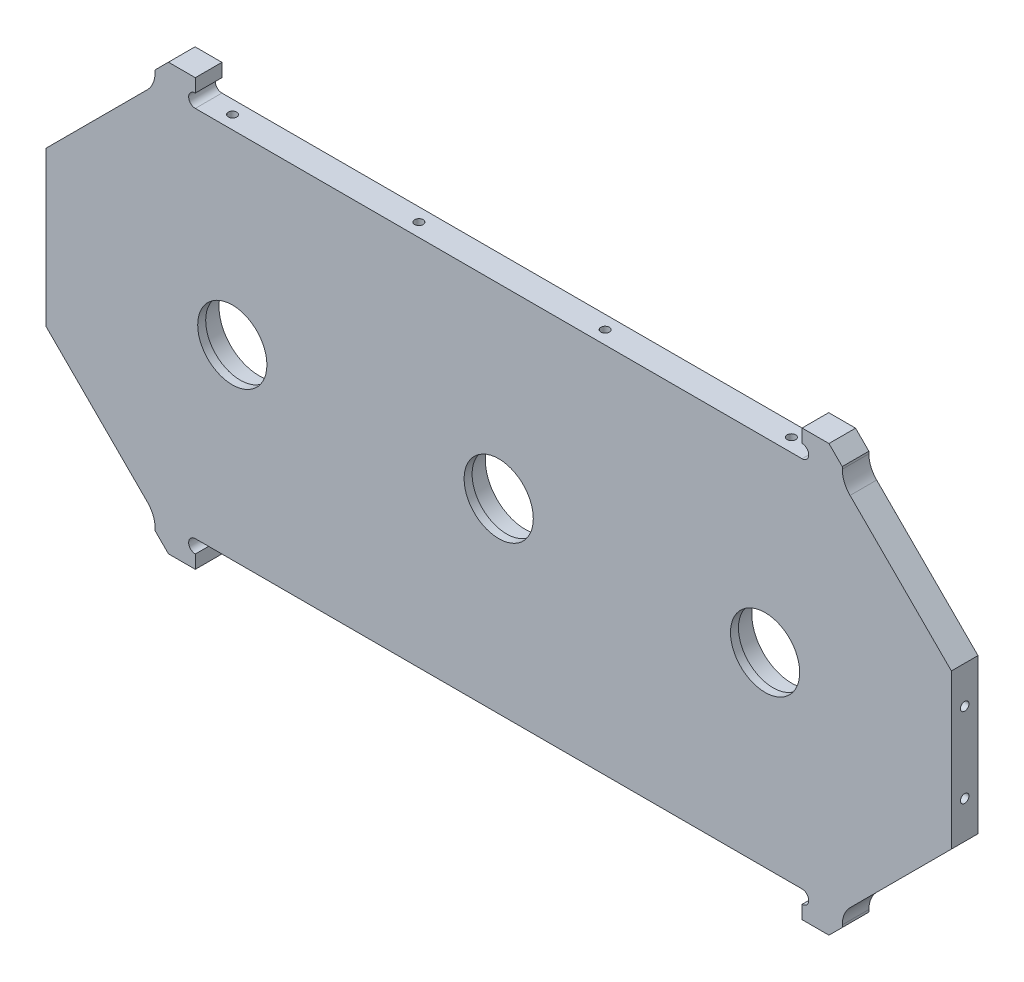
from build123d import *

# Parameters (mm, degrees)
SKETCH1_R               = 13
EXTRUDE1_DEPTH          = 10
SKETCH2_R               = 15
EXTRUDE2_DEPTH          = 7
EXTRUDE3_DEPTH          = 8
FILLET2_R               = 2
SKETCH4_R               = 1.6
EXTRUDE4_DEPTH          = 6
SKETCH5_W               = 15.094949366
SKETCH5_H               = 10
EXTRUDE5_DEPTH          = 10
SKETCH6_R               = 2.5
EXTRUDE6_DEPTH          = 189.23923608
MIRROR2_COPY_1_SKETCH_W = 15.094949366
MIRROR2_COPY_1_SKETCH_H = 10
MIRROR2_COPY_1_DEPTH    = 10
MIRROR2_COPY_2_SKETCH_R = 2.5
MIRROR2_COPY_2_DEPTH    = 189.23923608
FILLET3_R               = 10
CHAMFER1_SIZE           = 5
EXTRUDE7_REACH          = 351.623
SKETCH7_R               = 1.6


with BuildPart() as part:
    # Sketch1 → Extrude1 (new body)
    # profile 1 of 11: a face of its own
    with BuildSketch(Plane.XY):
        with BuildLine():
            Line((-129.094949366, 70), (-149.597474521, 49.497474845))
            ThreePointArc((-149.597474521, 49.497474845), (-126.88784016, 64.67156732), (-100.1, 70))
            Line((-100.1, 70), (-129.094949366, 70))
        make_face()
    # profile 2 of 11: a face of its own
    with BuildSketch(Plane.XY):
        with BuildLine():
            Line((-170.1, 28.994949366), (-170.1, 0))
            ThreePointArc((-170.1, 0), (-164.771567232, 26.787840371), (-149.597474521, 49.497474845))
            Line((-149.597474521, 49.497474845), (-170.1, 28.994949366))
        make_face()
    # profile 3 of 11: a face of its own
    with BuildSketch(Plane.XY):
        with BuildLine():
            Line((-170.1, -28.994949366), (-149.597474341, -49.497475025))
            ThreePointArc((-149.597474341, -49.497475025), (-164.771567183, -26.787840489), (-170.1, 0))
            Line((-170.1, 0), (-170.1, -28.994949366))
        make_face()
    # profile 4 of 11: a face of its own
    with BuildSketch(Plane.XY):
        with BuildLine():
            Line((-129.094949366, -70), (-100.1, -70))
            ThreePointArc((-100.1, -70), (-126.887840042, -64.671567368), (-149.597474341, -49.497475025))
            Line((-149.597474341, -49.497475025), (-129.094949366, -70))
        make_face()
    # profile 5 of 11: a face of its own
    with BuildSketch(Plane.XY):
        with BuildLine():
            Line((-100.1, -70), (-71.105050634, -70))
            Line((-71.105050634, -70), (-30.1, -28.994949366))
            Line((-30.1, -28.994949366), (-30.1, 28.994949366))
            Line((-30.1, 28.994949366), (-71.105050634, 70))
            Line((-71.105050634, 70), (-100.1, 70))
            ThreePointArc((-100.1, 70), (-126.88784016, 64.67156732), (-149.597474521, 49.497474845))
            ThreePointArc((-149.597474521, 49.497474845), (-164.771567232, 26.787840371), (-170.1, 0))
            ThreePointArc((-170.1, 0), (-164.771567183, -26.787840489), (-149.597474341, -49.497475025))
            ThreePointArc((-149.597474341, -49.497475025), (-126.887840042, -64.671567368), (-100.1, -70))
        make_face()
        with Locations((-100.1, 0)):
            Circle(SKETCH1_R, mode=Mode.SUBTRACT)
    # profile 6 of 11: a face of its own
    with BuildSketch(Plane.XY):
        Polygon((-71.105050634, -70), (71.105050634, -70), (30.1, -28.994949366), (30.1, 28.994949366), (71.105050634, 70), (-71.105050634, 70), (-30.1, 28.994949366), (-30.1, -28.994949366), align=None)
        Circle(SKETCH1_R, mode=Mode.SUBTRACT)
    # profile 7 of 11: a face of its own
    with BuildSketch(Plane.XY):
        with BuildLine():
            Line((71.105050634, -70), (100.1, -70))
            ThreePointArc((100.1, -70), (126.887840351, -64.67156724), (149.597474814, -49.497474552))
            ThreePointArc((149.597474814, -49.497474552), (164.77156738, -26.787840014), (170.1, 3.59e-07))
            ThreePointArc((170.1, 3.59e-07), (164.771567229, 26.787840379), (149.597474764, 49.497474602))
            ThreePointArc((149.597474764, 49.497474602), (126.887840318, 64.671567254), (100.1, 70))
            Line((100.1, 70), (71.105050634, 70))
            Line((71.105050634, 70), (30.1, 28.994949366))
            Line((30.1, 28.994949366), (30.1, -28.994949366))
            Line((30.1, -28.994949366), (71.105050634, -70))
        make_face()
        with Locations((100.1, 0)):
            Circle(SKETCH1_R, mode=Mode.SUBTRACT)
    # profile 8 of 11: a face of its own
    with BuildSketch(Plane.XY):
        with BuildLine():
            ThreePointArc((149.597474814, -49.497474552), (126.887840351, -64.67156724), (100.1, -70))
            Line((100.1, -70), (129.094949366, -70))
            Line((129.094949366, -70), (149.597474814, -49.497474552))
        make_face()
    # profile 9 of 11: a face of its own
    with BuildSketch(Plane.XY):
        with BuildLine():
            ThreePointArc((170.1, 3.59e-07), (164.77156738, -26.787840014), (149.597474814, -49.497474552))
            Line((149.597474814, -49.497474552), (170.1, -28.994949366))
            Line((170.1, -28.994949366), (170.1, 3.59e-07))
        make_face()
    # profile 10 of 11: a face of its own
    with BuildSketch(Plane.XY):
        with BuildLine():
            ThreePointArc((149.597474764, 49.497474602), (164.771567229, 26.787840379), (170.1, 3.59e-07))
            Line((170.1, 3.59e-07), (170.1, 28.994949366))
            Line((170.1, 28.994949366), (149.597474764, 49.497474602))
        make_face()
    # profile 11 of 11: a face of its own
    with BuildSketch(Plane.XY):
        with BuildLine():
            ThreePointArc((100.1, 70), (126.887840318, 64.671567254), (149.597474764, 49.497474602))
            Line((149.597474764, 49.497474602), (129.094949366, 70))
            Line((129.094949366, 70), (100.1, 70))
        make_face()
    extrude(amount=EXTRUDE1_DEPTH)

    # Sketch2 → Extrude2 (cut)
    with BuildSketch(Plane(origin=(0, 0, 0), x_dir=(-1, 0, 0), z_dir=(0, 0, -1))):
        Circle(SKETCH2_R)
        with Locations((-100.1, 0)):
            Circle(SKETCH2_R)
        with Locations((100.1, 0)):
            Circle(SKETCH2_R)
    extrude(amount=-EXTRUDE2_DEPTH, mode=Mode.SUBTRACT)

    # Sketch3 → Extrude3 (cut)
    with BuildSketch(Plane(origin=(0, 0, 0), x_dir=(-1, 0, 0), z_dir=(0, 0, -1))):
        with BuildLine():
            Line((-109.178349605, 16.690822881), (-128.140401721, 62.469266271))
            Line((-128.140401721, 62.469266271), (-162.569266271, 28.040401721))
            Line((-162.569266271, 28.040401721), (-116.790822881, 9.078349605))
            ThreePointArc((-116.790822881, 9.078349605), (-113.535028843, 13.435028843), (-109.178349605, 16.690822881))
        make_face()
        with BuildLine():
            ThreePointArc((-118.321556611, -5.382831475), (-119.1, 0), (-118.321556611, 5.382831475))
            Line((-118.321556611, 5.382831475), (-164.1, 24.344883591))
            Line((-164.1, 24.344883591), (-164.1, -24.344883591))
            Line((-164.1, -24.344883591), (-118.321556611, -5.382831475))
        make_face()
        with BuildLine():
            ThreePointArc((-109.178349605, -16.690822881), (-113.535028843, -13.435028843), (-116.790822881, -9.078349605))
            Line((-116.790822881, -9.078349605), (-162.569266271, -28.040401721))
            Line((-162.569266271, -28.040401721), (-128.140401721, -62.469266271))
            Line((-128.140401721, -62.469266271), (-109.178349605, -16.690822881))
        make_face()
        with BuildLine():
            Line((-75.755116409, -64), (-94.717168525, -18.221556611))
            ThreePointArc((-94.717168525, -18.221556611), (-100.1, -19), (-105.482831475, -18.221556611))
            Line((-105.482831475, -18.221556611), (-124.444883591, -64))
            Line((-124.444883591, -64), (-75.755116409, -64))
        make_face()
        with BuildLine():
            Line((-59.635919851, -64), (-5.22625186, -41.462777594))
            Line((-5.22625186, -41.462777594), (-83.409177119, -9.078349605))
            ThreePointArc((-83.409177119, -9.078349605), (-86.664971157, -13.435028843), (-91.021650395, -16.690822881))
            Line((-91.021650395, -16.690822881), (-71.425547608, -64))
            Line((-71.425547608, -64), (-59.635919851, -64))
        make_face()
        with BuildLine():
            ThreePointArc((-2, -18.894443628), (-13.435028843, -13.435028843), (-18.894443628, -2))
            Line((-18.894443628, -2), (-81.205556372, -2))
            ThreePointArc((-81.205556372, -2), (-81.465079672, -3.706716118), (-81.878443389, -5.382831475))
            Line((-81.878443389, -5.382831475), (-2, -38.469566068))
            Line((-2, -38.469566068), (-2, -18.894443628))
        make_face()
        with BuildLine():
            Line((-2, 18.894443628), (-2, 38.469566068))
            Line((-2, 38.469566068), (-81.878443389, 5.382831475))
            ThreePointArc((-81.878443389, 5.382831475), (-81.465079672, 3.706716118), (-81.205556372, 2))
            Line((-81.205556372, 2), (-18.894443628, 2))
            ThreePointArc((-18.894443628, 2), (-13.435028843, 13.435028843), (-2, 18.894443628))
        make_face()
        with BuildLine():
            Line((-5.22625186, 41.462777594), (-59.635919851, 64))
            Line((-59.635919851, 64), (-71.425547608, 64))
            Line((-71.425547608, 64), (-91.021650395, 16.690822881))
            ThreePointArc((-91.021650395, 16.690822881), (-86.664971157, 13.435028843), (-83.409177119, 9.078349605))
            Line((-83.409177119, 9.078349605), (-5.22625186, 41.462777594))
        make_face()
        with BuildLine():
            Line((-94.717168525, 18.221556611), (-75.755116409, 64))
            Line((-75.755116409, 64), (-124.444883591, 64))
            Line((-124.444883591, 64), (-105.482831475, 18.221556611))
            ThreePointArc((-105.482831475, 18.221556611), (-100.1, 19), (-94.717168525, 18.221556611))
        make_face()
        Polygon((-2, 44.455989119), (-2, 64), (-49.183416132, 64), align=None)
        Polygon((2, 44.455989119), (2, 64), (-2, 64), (-2, 44.455989119), (0, 43.627561994), align=None)
        Polygon((2, 44.455989119), (49.183416132, 64), (2, 64), align=None)
        Polygon((-2, -64), (-2, -44.455989119), (-49.183416132, -64), align=None)
        Polygon((49.183416132, -64), (2, -44.455989119), (2, -64), align=None)
        Polygon((2, -44.455989119), (0, -43.627561994), (-2, -44.455989119), (-2, -64), (2, -64), align=None)
        with BuildLine():
            ThreePointArc((91.021650395, -16.690822881), (86.664971157, -13.435028843), (83.409177119, -9.078349605))
            Line((83.409177119, -9.078349605), (5.22625186, -41.462777594))
            Line((5.22625186, -41.462777594), (59.635919851, -64))
            Line((59.635919851, -64), (71.425547608, -64))
            Line((71.425547608, -64), (91.021650395, -16.690822881))
        make_face()
        with BuildLine():
            ThreePointArc((81.878443389, -5.382831475), (81.465079672, -3.706716118), (81.205556372, -2))
            Line((81.205556372, -2), (18.894443628, -2))
            ThreePointArc((18.894443628, -2), (13.435028843, -13.435028843), (2, -18.894443628))
            Line((2, -18.894443628), (2, -38.469566068))
            Line((2, -38.469566068), (81.878443389, -5.382831475))
        make_face()
        with BuildLine():
            ThreePointArc((81.205556372, 2), (81.465079672, 3.706716118), (81.878443389, 5.382831475))
            Line((81.878443389, 5.382831475), (2, 38.469566068))
            Line((2, 38.469566068), (2, 18.894443628))
            ThreePointArc((2, 18.894443628), (13.435028843, 13.435028843), (18.894443628, 2))
            Line((18.894443628, 2), (81.205556372, 2))
        make_face()
        with BuildLine():
            Line((91.021650395, 16.690822881), (71.425547608, 64))
            Line((71.425547608, 64), (59.635919851, 64))
            Line((59.635919851, 64), (5.22625186, 41.462777594))
            Line((5.22625186, 41.462777594), (83.409177119, 9.078349605))
            ThreePointArc((83.409177119, 9.078349605), (86.664971157, 13.435028843), (91.021650395, 16.690822881))
        make_face()
        with BuildLine():
            Line((105.482831475, 18.221556611), (124.444883591, 64))
            Line((124.444883591, 64), (75.755116409, 64))
            Line((75.755116409, 64), (94.717168525, 18.221556611))
            ThreePointArc((94.717168525, 18.221556611), (100.1, 19), (105.482831475, 18.221556611))
        make_face()
        with BuildLine():
            Line((162.569266271, 28.040401721), (128.140401721, 62.469266271))
            Line((128.140401721, 62.469266271), (109.178349605, 16.690822881))
            ThreePointArc((109.178349605, 16.690822881), (113.535028843, 13.435028843), (116.790822881, 9.078349605))
            Line((116.790822881, 9.078349605), (162.569266271, 28.040401721))
        make_face()
        with BuildLine():
            Line((164.1, -24.344883591), (164.1, 24.344883591))
            Line((164.1, 24.344883591), (118.321556611, 5.382831475))
            ThreePointArc((118.321556611, 5.382831475), (118.904382144, 2.719413944), (119.1, 0))
            ThreePointArc((119.1, 0), (118.904382144, -2.719413944), (118.321556611, -5.382831475))
            Line((118.321556611, -5.382831475), (164.1, -24.344883591))
        make_face()
        with BuildLine():
            Line((128.140401721, -62.469266271), (162.569266271, -28.040401721))
            Line((162.569266271, -28.040401721), (116.790822881, -9.078349605))
            ThreePointArc((116.790822881, -9.078349605), (113.535028843, -13.435028843), (109.178349605, -16.690822881))
            Line((109.178349605, -16.690822881), (128.140401721, -62.469266271))
        make_face()
        with BuildLine():
            Line((124.444883591, -64), (105.482831475, -18.221556611))
            ThreePointArc((105.482831475, -18.221556611), (100.1, -19), (94.717168525, -18.221556611))
            Line((94.717168525, -18.221556611), (75.755116409, -64))
            Line((75.755116409, -64), (124.444883591, -64))
        make_face()
    extrude(amount=-EXTRUDE3_DEPTH, mode=Mode.SUBTRACT)

    # Fillet2
    fillet2_edges = [part.edges().sort_by_distance(p)[0] for p in [
        (-83.409177119, -9.078349605, 4),
        (-91.021650395, -16.690822881, 4),
        (-71.425547608, -64, 4),
        (-59.635919851, -64, 4),
        (-5.22625186, -41.462777594, 4),
        (-81.205556372, -2, 4),
        (-81.878443389, -5.382831475, 4),
        (-2, -38.469566068, 4),
        (-2, -18.894443628, 4),
        (-18.894443628, -2, 4),
        (-49.183416132, -64, 4),
        (49.183416132, -64, 4),
        (0, -43.627561994, 4),
        (0, 43.627561994, 4),
        (49.183416132, 64, 4),
        (-49.183416132, 64, 4),
        (-105.482831475, 18.221556611, 4),
        (-94.717168525, 18.221556611, 4),
        (-75.755116409, 64, 4),
        (-124.444883591, 64, 4),
        (-116.790822881, 9.078349605, 4),
        (-109.178349605, 16.690822881, 4),
        (-128.140401721, 62.469266271, 4),
        (-162.569266271, 28.040401721, 4),
        (-81.878443389, 5.382831475, 4),
        (-81.205556372, 2, 4),
        (-18.894443628, 2, 4),
        (-2, 18.894443628, 4),
        (-2, 38.469566068, 4),
        (-91.021650395, 16.690822881, 4),
        (-83.409177119, 9.078349605, 4),
        (-5.22625186, 41.462777594, 4),
        (-59.635919851, 64, 4),
        (-71.425547608, 64, 4),
        (105.482831475, -18.221556611, 4),
        (94.717168525, -18.221556611, 4),
        (75.755116409, -64, 4),
        (124.444883591, -64, 4),
        (91.021650395, -16.690822881, 4),
        (83.409177119, -9.078349605, 4),
        (5.22625186, -41.462777594, 4),
        (59.635919851, -64, 4),
        (71.425547608, -64, 4),
        (118.321556611, 5.382831475, 4),
        (118.321556611, -5.382831475, 4),
        (164.1, -24.344883591, 4),
        (164.1, 24.344883591, 4),
        (116.790822881, -9.078349605, 4),
        (109.178349605, -16.690822881, 4),
        (128.140401721, -62.469266271, 4),
        (162.569266271, -28.040401721, 4),
        (83.409177119, 9.078349605, 4),
        (91.021650395, 16.690822881, 4),
        (71.425547608, 64, 4),
        (59.635919851, 64, 4),
        (5.22625186, 41.462777594, 4),
        (94.717168525, 18.221556611, 4),
        (105.482831475, 18.221556611, 4),
        (124.444883591, 64, 4),
        (75.755116409, 64, 4),
        (2, 18.894443628, 4),
        (18.894443628, 2, 4),
        (81.205556372, 2, 4),
        (81.878443389, 5.382831475, 4),
        (2, 38.469566068, 4),
        (18.894443628, -2, 4),
        (2, -18.894443628, 4),
        (2, -38.469566068, 4),
        (81.878443389, -5.382831475, 4),
        (81.205556372, -2, 4),
        (-94.717168525, -18.221556611, 4),
        (-105.482831475, -18.221556611, 4),
        (-124.444883591, -64, 4),
        (-75.755116409, -64, 4),
        (-118.321556611, -5.382831475, 4),
        (-118.321556611, 5.382831475, 4),
        (-164.1, 24.344883591, 4),
        (-164.1, -24.344883591, 4),
        (-109.178349605, -16.690822881, 4),
        (-116.790822881, -9.078349605, 4),
        (-162.569266271, -28.040401721, 4),
        (-128.140401721, -62.469266271, 4),
        (109.178349605, 16.690822881, 4),
        (116.790822881, 9.078349605, 4),
        (162.569266271, 28.040401721, 4),
        (128.140401721, 62.469266271, 4),
    ]]
    fillet(fillet2_edges, radius=FILLET2_R)

    # Sketch4 → Extrude4 (cut)
    with BuildSketch(Plane(origin=(0, 70, 0), x_dir=(1, 0, 0), z_dir=(0, 1, 0))):
        with Locations(Location((35, -5, 0), (0, 0, 180))):
            Circle(SKETCH4_R)
        with Locations(Location((105, -5, 0), (0, 0, 180))):
            Circle(SKETCH4_R)
        with Locations((-105, -5)):
            Circle(SKETCH4_R)
        with Locations((-35, -5)):
            Circle(SKETCH4_R)
    extrude4 = extrude(amount=-EXTRUDE4_DEPTH, mode=Mode.SUBTRACT)

    # Sketch5 → Extrude5 (add)
    with BuildSketch(Plane(origin=(0, 0, 0), x_dir=(-1, 0, 0), z_dir=(0, 0, -1))):
        with Locations((-121.547474683, 75)):
            Rectangle(SKETCH5_W, SKETCH5_H)
    extrude5 = extrude(amount=-EXTRUDE5_DEPTH)

    # Sketch6 → Extrude6 (cut, through all)
    with BuildSketch(Plane(origin=(0, 0, 0), x_dir=(-1, 0, 0), z_dir=(0, 0, -1))):
        with Locations((-114, 72.5)):
            Circle(SKETCH6_R)
    extrude6 = extrude(amount=-EXTRUDE6_DEPTH, mode=Mode.SUBTRACT)

    # Mirror1: Extrude5, Extrude6 across plane
    add(extrude5.mirror(Plane.ZX))
    add(extrude6.mirror(Plane.ZX), mode=Mode.SUBTRACT)

    # Mirror2: Extrude5, Extrude6 across plane
    add(extrude5.mirror(Plane(origin=(0, 0, 0), x_dir=(0, 0, 1), z_dir=(1, 0, 0))))
    add(extrude6.mirror(Plane(origin=(0, 0, 0), x_dir=(0, 0, 1), z_dir=(1, 0, 0))), mode=Mode.SUBTRACT)

    # Mirror2 copy 1 sketch → Mirror2 copy 1 (add)
    with BuildSketch(Plane(origin=(0, 0, 0), x_dir=(1, 0, 0), z_dir=(0, 0, -1))):
        with Locations((-121.547474683, 75)):
            Rectangle(MIRROR2_COPY_1_SKETCH_W, MIRROR2_COPY_1_SKETCH_H)
    extrude(amount=-MIRROR2_COPY_1_DEPTH)

    # Mirror2 copy 2 sketch → Mirror2 copy 2 (cut, through all)
    with BuildSketch(Plane(origin=(0, 0, 0), x_dir=(1, 0, 0), z_dir=(0, 0, -1))):
        with Locations((-114, 72.5)):
            Circle(MIRROR2_COPY_2_SKETCH_R)
    extrude(amount=-MIRROR2_COPY_2_DEPTH, mode=Mode.SUBTRACT)

    # Mirror3: Extrude4 across plane
    add(extrude4.mirror(Plane.ZX), mode=Mode.SUBTRACT)

    # Fillet3
    fillet3_edges = [part.edges().sort_by_distance(p)[0] for p in [
        (-129.094949366, -70, 5),
        (-129.094949366, 70, 5),
        (129.094949366, 70, 5),
        (129.094949366, -70, 5),
    ]]
    fillet(fillet3_edges, radius=FILLET3_R)

    # Chamfer1
    chamfer1_edges = [part.edges().sort_by_distance(p)[0] for p in [
        (129.094949366, 80, 5),
        (129.094949366, -80, 5),
        (-129.094949366, -80, 5),
        (-129.094949366, 80, 5),
    ]]
    chamfer(chamfer1_edges, length=CHAMFER1_SIZE)

    # Sketch7 → Extrude7 (cut, up to next)
    with BuildSketch(Plane(origin=(170.1, 0, 0), x_dir=(0, 0, -1), z_dir=(1, 0, 0)), mode=Mode.PRIVATE) as extrude7_sk1:
        with Locations((-5, 15)):
            Circle(SKETCH7_R)
    extrude7_tool1 = extrude(extrude7_sk1.sketch, amount=-EXTRUDE7_REACH, mode=Mode.PRIVATE) & part.part
    # Sketch7 → Extrude7 (cut, up to next)
    with BuildSketch(Plane(origin=(170.1, 0, 0), x_dir=(0, 0, -1), z_dir=(1, 0, 0)), mode=Mode.PRIVATE) as extrude7_sk2:
        with Locations((-5, -15)):
            Circle(SKETCH7_R)
    extrude7_tool2 = extrude(extrude7_sk2.sketch, amount=-EXTRUDE7_REACH, mode=Mode.PRIVATE) & part.part
    extrude7_1 = extrude7_tool1.solids().sort_by_distance((170.1, 15, 5))[0]
    add(extrude7_1, mode=Mode.SUBTRACT)
    extrude7_2 = extrude7_tool2.solids().sort_by_distance((170.1, -15, 5))[0]
    add(extrude7_2, mode=Mode.SUBTRACT)
    extrude7 = extrude7_1 + extrude7_2  # Extrude7 as one shape, for the pattern or mirror that repeats it

    # Mirror4: Extrude7 across plane
    add(extrude7.mirror(Plane(origin=(0, 0, 0), x_dir=(0, 0, 1), z_dir=(1, 0, 0))), mode=Mode.SUBTRACT)


solid = part.part
